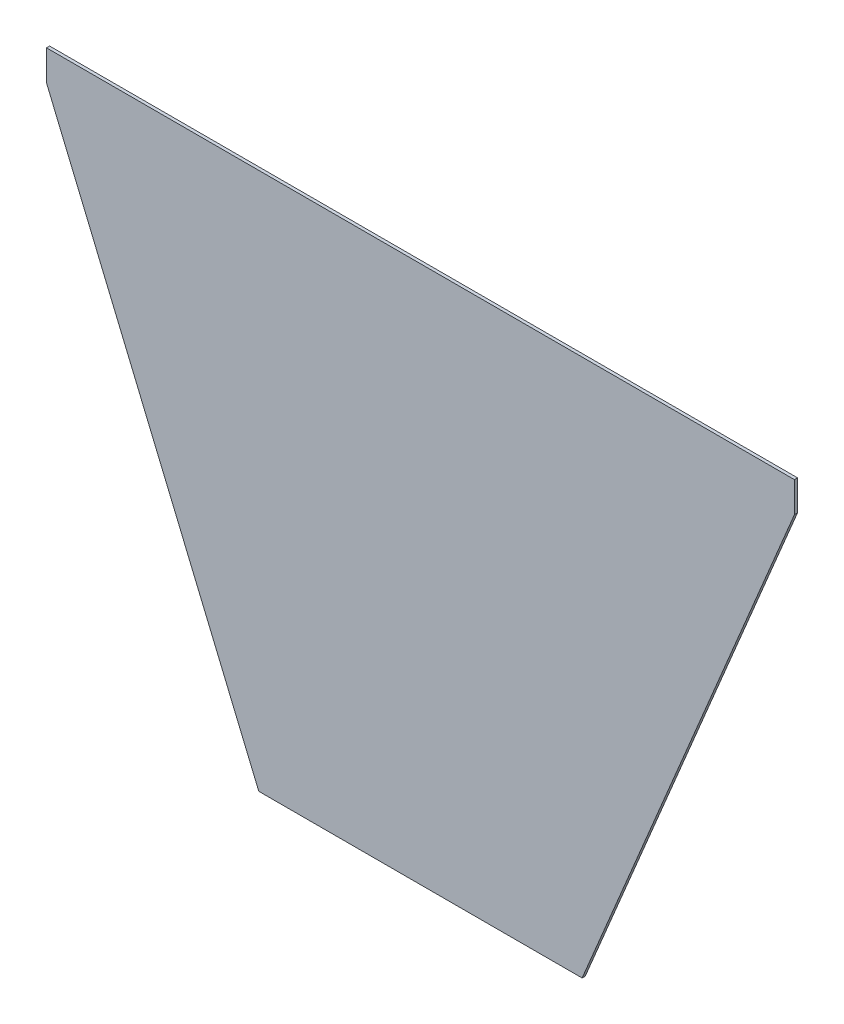
from build123d import *

# Parameters (mm, degrees)
EXTRUDE_1_DEPTH = 5


with BuildPart() as part:
    # 草图1 → 凸台-拉伸1 (new body)
    with BuildSketch(Plane.XY):
        Polygon((-603.605, 0), (603.605, 0), (603.605, -49), (260.935, -868), (-260.935, -868), (-603.605, -49), align=None)
    extrude(amount=EXTRUDE_1_DEPTH)


solid = part.part
